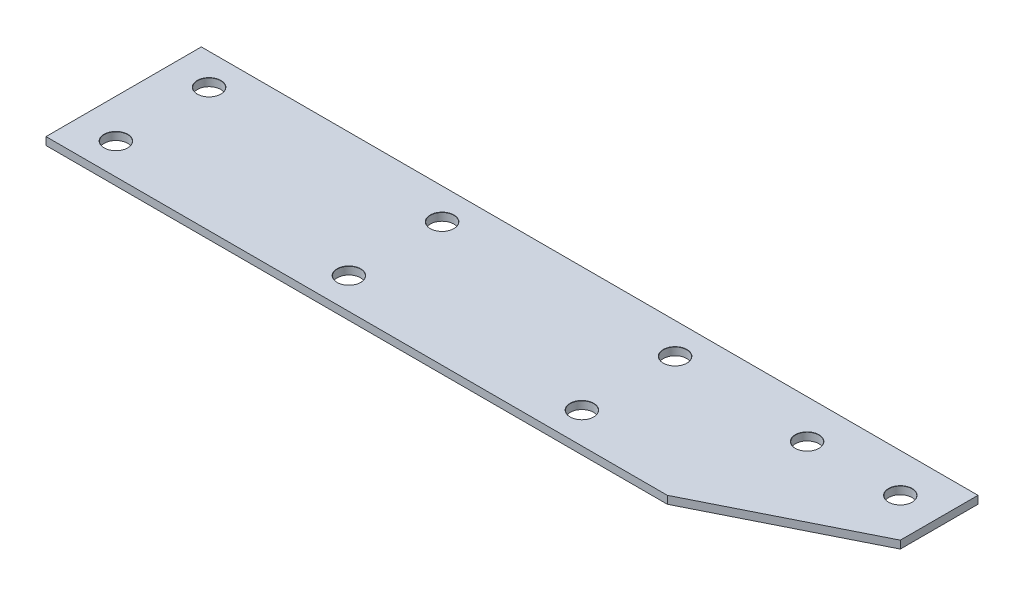
from build123d import *

# Parameters (mm, degrees)
EXTRUDE_1_DEPTH      = 1
F_3_0MM_1_AT_2_COUNT = 2
F_3_0MM_1_AT_2_PITCH = 12
F_3_0MM_1_AT_3_COUNT = 2
F_3_0MM_1_AT_3_PITCH = 30
F_3_0MM_1_AT_4_COUNT = 2
F_3_0MM_1_AT_4_PITCH = 60
F_3_0MM_1_AT_5_COUNT = 2
F_3_0MM_1_AT_5_PITCH = 32.310988843
F_3_0MM_1_AT_6_COUNT = 2
F_3_0MM_1_AT_6_PITCH = 61.188234163
F_3_0MM_1_AT_7_COUNT = 2
F_3_0MM_1_AT_7_PITCH = 78.006409993
F_3_0MM_1_AT_8_COUNT = 2
F_3_0MM_1_AT_8_PITCH = 90.005555384


with BuildPart() as part:
    # 草图1 → 凸台-拉伸1 (new body)
    with BuildSketch(Plane(origin=(0, 0, 0), x_dir=(1, 0, 0), z_dir=(0, 1, 0))):
        Polygon((100, 10), (80, 0), (0, 0), (0, 20), (100, 20), align=None)
    extrude(amount=EXTRUDE_1_DEPTH)

    # 草图3 → Ø3.0mm 暗销孔1 (revolve, cut)
    with BuildSketch(Plane(origin=(5, 1, -16), x_dir=(0, 0, 1), z_dir=(1, 0, 0))):
        Polygon((0, 0), (0, 1), (1.5, 1), (1.5, 0.025), (1.525, 0), align=None)
    f_3_0mm_1 = revolve(axis=Axis((5, 7.35, -16), (0, -1, 0)), mode=Mode.SUBTRACT)

    # Ø3.0mm 暗销孔1 at 2: Ø3.0mm 暗销孔1 ×2
    with Locations(*[(0, 0, i * F_3_0MM_1_AT_2_PITCH) for i in range(1, F_3_0MM_1_AT_2_COUNT)]):
        add(f_3_0mm_1, mode=Mode.SUBTRACT)

    # Ø3.0mm 暗销孔1 at 3: Ø3.0mm 暗销孔1 ×2
    with Locations(*[(i * F_3_0MM_1_AT_3_PITCH, 0, 0) for i in range(1, F_3_0MM_1_AT_3_COUNT)]):
        add(f_3_0mm_1, mode=Mode.SUBTRACT)

    # Ø3.0mm 暗销孔1 at 4: Ø3.0mm 暗销孔1 ×2
    with Locations(*[(i * F_3_0MM_1_AT_4_PITCH, 0, 0) for i in range(1, F_3_0MM_1_AT_4_COUNT)]):
        add(f_3_0mm_1, mode=Mode.SUBTRACT)

    # Ø3.0mm 暗销孔1 at 5: Ø3.0mm 暗销孔1 ×2
    with Locations(*[Vector(0.9284766908852593, 0, 0.37139067635410383) * (i * F_3_0MM_1_AT_5_PITCH) for i in range(1, F_3_0MM_1_AT_5_COUNT)]):
        add(f_3_0mm_1, mode=Mode.SUBTRACT)

    # Ø3.0mm 暗销孔1 at 6: Ø3.0mm 暗销孔1 ×2
    with Locations(*[Vector(0.9805806756909202, 0, 0.19611613513818404) * (i * F_3_0MM_1_AT_6_PITCH) for i in range(1, F_3_0MM_1_AT_6_COUNT)]):
        add(f_3_0mm_1, mode=Mode.SUBTRACT)

    # Ø3.0mm 暗销孔1 at 7: Ø3.0mm 暗销孔1 ×2
    with Locations(*[Vector(0.9999178273551348, 0, 0.01281945932506583) * (i * F_3_0MM_1_AT_7_PITCH) for i in range(1, F_3_0MM_1_AT_7_COUNT)]):
        add(f_3_0mm_1, mode=Mode.SUBTRACT)

    # Ø3.0mm 暗销孔1 at 8: Ø3.0mm 暗销孔1 ×2
    with Locations(*[Vector(0.9999382773199424, 0, 0.011110425303554916) * (i * F_3_0MM_1_AT_8_PITCH) for i in range(1, F_3_0MM_1_AT_8_COUNT)]):
        add(f_3_0mm_1, mode=Mode.SUBTRACT)


solid = part.part
